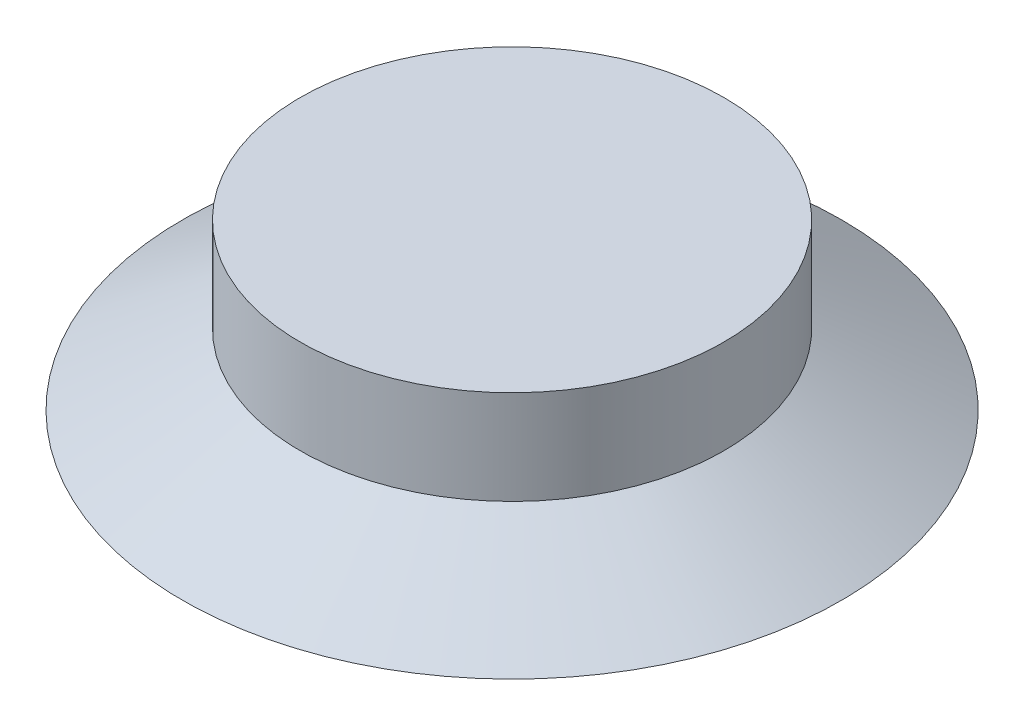
from build123d import *

# Parameters (mm, degrees)
CROQUIS1_W = 4.5
CROQUIS1_H = 2


with BuildPart() as part:
    # Croquis1 → Revolución1 (revolve)
    with BuildSketch(Plane.XY, mode=Mode.PRIVATE) as revoluci_n1_sk:
        Rectangle(CROQUIS1_W, CROQUIS1_H)
        Polygon((-2.25, -2.5), (-2.25, -1), (2.25, -1), (4.75, -2.5), align=None)
    revolve(revoluci_n1_sk.sketch.rotate(Axis((-2.25, -1, 0), (0, 1, 0)), 90), axis=Axis((-2.25, -1, 0), (0, 1, 0)))


solid = part.part
